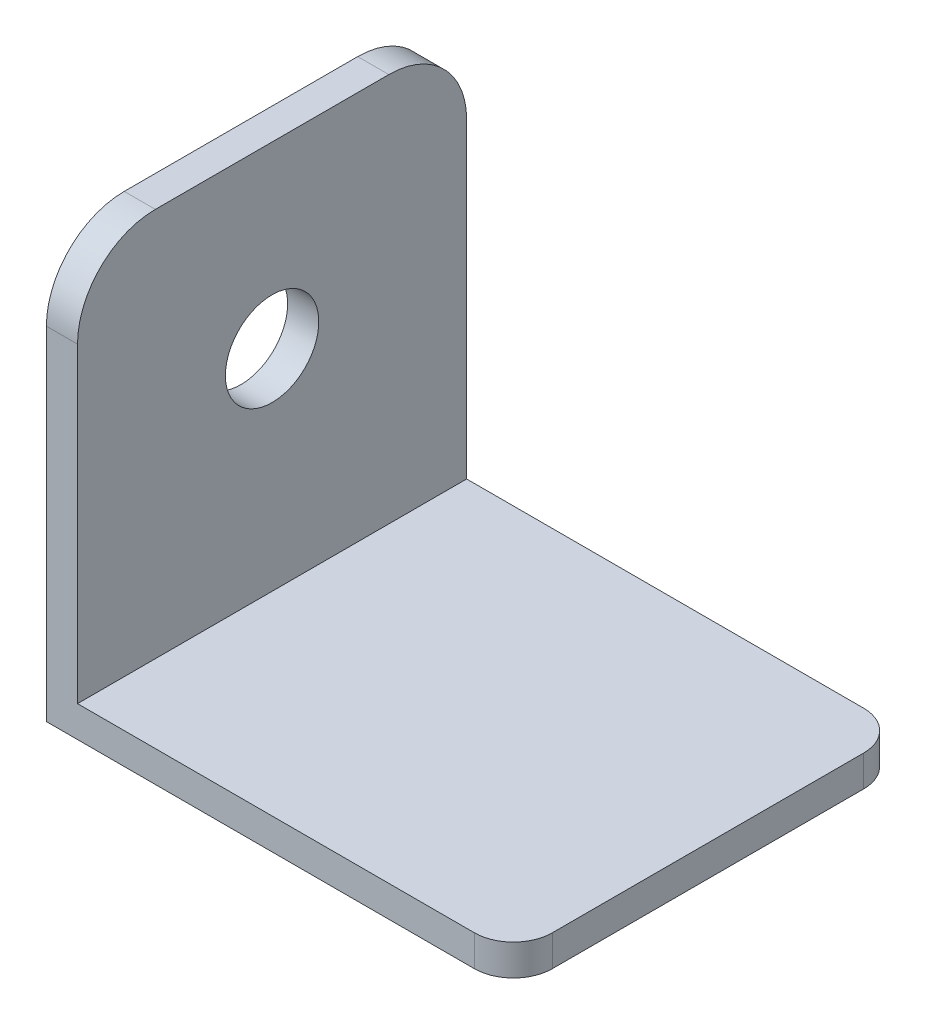
from build123d import *

# Parameters (mm, degrees)
SKETCH1_W           = 60
SKETCH1_H           = 50
BOSS_EXTRUDE3_DEPTH = 4
SKETCH3_R           = 6
BOSS_EXTRUDE4_DEPTH = 4
FILLET1_R           = 5


with BuildPart() as part:
    # Sketch1 → Boss-Extrude3 (new body)
    with BuildSketch(Plane(origin=(0, 0, 0), x_dir=(1, 0, 0), z_dir=(0, 1, 0))):
        Rectangle(SKETCH1_W, SKETCH1_H)
    extrude(amount=BOSS_EXTRUDE3_DEPTH)

    # Sketch3 → Boss-Extrude4 (add)
    with BuildSketch(Plane.ZY.offset(30)):
        with BuildLine():
            Line((-25, 4), (25, 4))
            Line((25, 4), (25, 44))
            ThreePointArc((25, 44), (22.071067812, 51.071067812), (15, 54))
            Line((15, 54), (-15, 54))
            ThreePointArc((-15, 54), (-22.071067812, 51.071067812), (-25, 44))
            Line((-25, 44), (-25, 4))
        make_face()
        with Locations((0, 31)):
            Circle(SKETCH3_R, mode=Mode.SUBTRACT)
    extrude(amount=-BOSS_EXTRUDE4_DEPTH)

    # Fillet1
    fillet1_edges = [part.edges().sort_by_distance(p)[0] for p in [
        (30, 2, 25),
        (30, 2, -25),
    ]]
    fillet(fillet1_edges, radius=FILLET1_R)


solid = part.part
